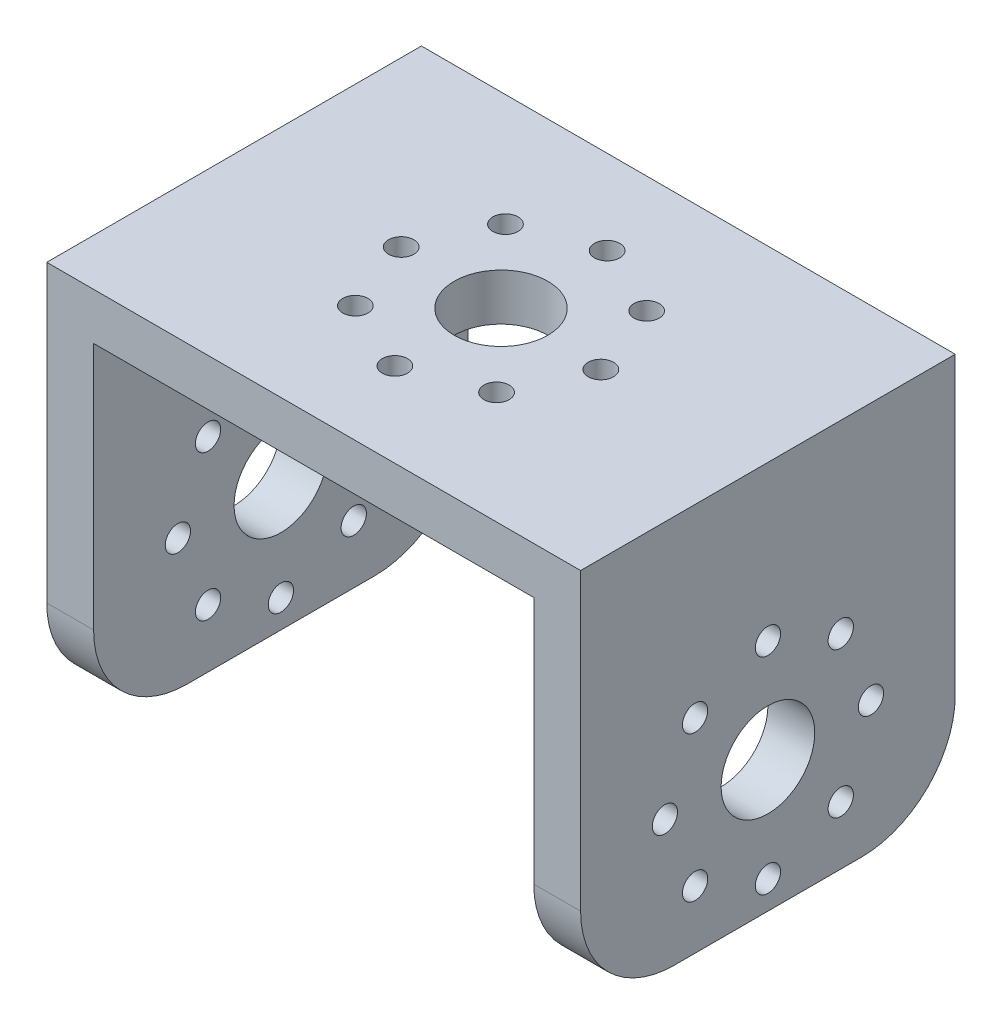
from build123d import *

# Parameters (mm, degrees)
SKETCH4_R               = 5
SKETCH4_R_2             = 1.35
BOSS_EXTRUDE1_DEPTH     = 3
SKETCH5_W               = 3
SKETCH5_H               = 40
BOSS_EXTRUDE2_DEPTH     = 60
CUT_EXTRUDE1_DEPTH      = 83.516664984
CUT_EXTRUDE1_DEPTH_BACK = 83.516664984
SKETCH7_R               = 5
SKETCH7_R_2             = 1.35
SKETCH8_R               = 5
SKETCH8_R_2             = 1.35
BOSS_EXTRUDE3_DEPTH     = 2
BOSS_EXTRUDE4_START     = -5
SKETCH10_R              = 5
SKETCH10_R_2            = 1.35
BOSS_EXTRUDE4_DEPTH     = 5
BOSS_EXTRUDE5_START     = -57
BOSS_EXTRUDE5_DEPTH     = 5


with BuildPart() as part:
    # Sketch4 → Boss-Extrude1 (new body)
    with BuildSketch(Plane(origin=(0, 0, 0), x_dir=(1, 0, 0), z_dir=(0, 1, 0))):
        Polygon((0, -20), (26.5, -20), (26.5, 20), (0, 20), (-26.5, 20), (-26.5, -20), align=None)
        with Locations(Location((0, 0, 0), (0, 0, 270))):
            Circle(SKETCH4_R, mode=Mode.SUBTRACT)
        with Locations(Location((8.012214677, 7.536870436, 0), (0, 0, 270))):
            Circle(SKETCH4_R_2, mode=Mode.SUBTRACT)
        with Locations(Location((10.994863525, -0.336119137, 0), (0, 0, 270))):
            Circle(SKETCH4_R_2, mode=Mode.SUBTRACT)
        with Locations(Location((0.336119137, 10.994863525, 0), (0, 0, 270))):
            Circle(SKETCH4_R_2, mode=Mode.SUBTRACT)
        with Locations(Location((-7.536870436, 8.012214677, 0), (0, 0, 270))):
            Circle(SKETCH4_R_2, mode=Mode.SUBTRACT)
        with Locations(Location((-10.994863525, 0.336119137, 0), (0, 0, 270))):
            Circle(SKETCH4_R_2, mode=Mode.SUBTRACT)
        with Locations(Location((-8.012214677, -7.536870436, 0), (0, 0, 270))):
            Circle(SKETCH4_R_2, mode=Mode.SUBTRACT)
        with Locations(Location((-0.336119137, -10.994863525, 0), (0, 0, 270))):
            Circle(SKETCH4_R_2, mode=Mode.SUBTRACT)
        with Locations(Location((7.536870436, -8.012214677, 0), (0, 0, 270))):
            Circle(SKETCH4_R_2, mode=Mode.SUBTRACT)
    extrude(amount=BOSS_EXTRUDE1_DEPTH)

    # Sketch5 → Boss-Extrude2 (add)
    with BuildSketch(Plane.XZ):
        with Locations((-25, 0)):
            Rectangle(SKETCH5_W, SKETCH5_H)
        with Locations((25, 0)):
            Rectangle(SKETCH5_W, SKETCH5_H)
    extrude(amount=BOSS_EXTRUDE2_DEPTH)

    # Sketch7 → Cut-Extrude1 (cut, two sides: drawn at the far end of the back side and taken through both)
    with BuildSketch(Plane(origin=(26.5, 0, 0), x_dir=(0, 0, -1), z_dir=(1, 0, 0)).offset(-CUT_EXTRUDE1_DEPTH_BACK)):
        with BuildLine():
            ThreePointArc((-10, -36.5), (-17.071067812, -33.571067812), (-20, -26.5))
            Line((-20, -26.5), (-20, -60))
            Line((-20, -60), (20, -60))
            Line((20, -60), (20, -26.5))
            ThreePointArc((20, -26.5), (17.071067812, -33.571067812), (10, -36.5))
            Line((10, -36.5), (-10, -36.5))
        make_face()
        with Locations((0, -22.5)):
            Circle(SKETCH7_R)
        with Locations((0, -11.5)):
            Circle(SKETCH7_R_2)
        with Locations((7.778174593, -14.721825407)):
            Circle(SKETCH7_R_2)
        with Locations((11, -22.5)):
            Circle(SKETCH7_R_2)
        with Locations((7.778174593, -30.278174593)):
            Circle(SKETCH7_R_2)
        with Locations((0, -33.5)):
            Circle(SKETCH7_R_2)
        with Locations((-7.778174593, -30.278174593)):
            Circle(SKETCH7_R_2)
        with Locations((-11, -22.5)):
            Circle(SKETCH7_R_2)
        with Locations((-7.778174593, -14.721825407)):
            Circle(SKETCH7_R_2)
    extrude(amount=CUT_EXTRUDE1_DEPTH + CUT_EXTRUDE1_DEPTH_BACK, mode=Mode.SUBTRACT)

    # Sketch8 → Boss-Extrude3 (add)
    with BuildSketch(Plane(origin=(0, 3, 0), x_dir=(1, 0, 0), z_dir=(0, 1, 0))):
        Polygon((-26.5, 20), (26.5, 20), (28.5, 20), (28.5, -20), (26.5, -20), (-26.5, -20), (-28.5, -20), (-28.5, 20), align=None)
        with Locations(Location((0, 0, 0), (0, 0, 270))):
            Circle(SKETCH8_R, mode=Mode.SUBTRACT)
        with Locations(Location((8.012214677, 7.536870436, 0), (0, 0, 270))):
            Circle(SKETCH8_R_2, mode=Mode.SUBTRACT)
        with Locations(Location((0.336119137, 10.994863525, 0), (0, 0, 270))):
            Circle(SKETCH8_R_2, mode=Mode.SUBTRACT)
        with Locations(Location((-7.536870436, 8.012214677, 0), (0, 0, 270))):
            Circle(SKETCH8_R_2, mode=Mode.SUBTRACT)
        with Locations(Location((-10.994863525, 0.336119137, 0), (0, 0, 270))):
            Circle(SKETCH8_R_2, mode=Mode.SUBTRACT)
        with Locations(Location((-8.012214677, -7.536870436, 0), (0, 0, 270))):
            Circle(SKETCH8_R_2, mode=Mode.SUBTRACT)
        with Locations(Location((-0.336119137, -10.994863525, 0), (0, 0, 270))):
            Circle(SKETCH8_R_2, mode=Mode.SUBTRACT)
        with Locations(Location((7.536870436, -8.012214677, 0), (0, 0, 270))):
            Circle(SKETCH8_R_2, mode=Mode.SUBTRACT)
        with Locations(Location((10.994863525, -0.336119137, 0), (0, 0, 270))):
            Circle(SKETCH8_R_2, mode=Mode.SUBTRACT)
    extrude(amount=BOSS_EXTRUDE3_DEPTH)

    # Sketch10 → Boss-Extrude4 (add)
    with BuildSketch(Plane.ZY.offset(28.5).offset(BOSS_EXTRUDE4_START)):
        with BuildLine():
            Line((-20, 3), (-20, -26.5))
            ThreePointArc((-20, -26.5), (-17.071067812, -33.571067812), (-10, -36.5))
            Line((-10, -36.5), (10, -36.5))
            ThreePointArc((10, -36.5), (17.071067812, -33.571067812), (20, -26.5))
            Line((20, -26.5), (20, 3))
            Line((20, 3), (-20, 3))
        make_face()
        with Locations(Location((0, -22.5, 0), (0, 0, 180))):
            Circle(SKETCH10_R, mode=Mode.SUBTRACT)
        with Locations(Location((-7.778174593, -14.721825407, 0), (0, 0, 180))):
            Circle(SKETCH10_R_2, mode=Mode.SUBTRACT)
        with Locations(Location((-11, -22.5, 0), (0, 0, 180))):
            Circle(SKETCH10_R_2, mode=Mode.SUBTRACT)
        with Locations(Location((-7.778174593, -30.278174593, 0), (0, 0, 180))):
            Circle(SKETCH10_R_2, mode=Mode.SUBTRACT)
        with Locations(Location((0, -33.5, 0), (0, 0, 180))):
            Circle(SKETCH10_R_2, mode=Mode.SUBTRACT)
        with Locations(Location((7.778174593, -30.278174593, 0), (0, 0, 180))):
            Circle(SKETCH10_R_2, mode=Mode.SUBTRACT)
        with Locations(Location((11, -22.5, 0), (0, 0, 180))):
            Circle(SKETCH10_R_2, mode=Mode.SUBTRACT)
        with Locations(Location((7.778174593, -14.721825407, 0), (0, 0, 180))):
            Circle(SKETCH10_R_2, mode=Mode.SUBTRACT)
        with Locations(Location((0, -11.5, 0), (0, 0, 180))):
            Circle(SKETCH10_R_2, mode=Mode.SUBTRACT)
    extrude(amount=BOSS_EXTRUDE4_DEPTH)

    # Sketch10 → Boss-Extrude5 (add)
    with BuildSketch(Plane.ZY.offset(28.5).offset(BOSS_EXTRUDE5_START)):
        with BuildLine():
            Line((-20, 3), (-20, -26.5))
            ThreePointArc((-20, -26.5), (-17.071067812, -33.571067812), (-10, -36.5))
            Line((-10, -36.5), (10, -36.5))
            ThreePointArc((10, -36.5), (17.071067812, -33.571067812), (20, -26.5))
            Line((20, -26.5), (20, 3))
            Line((20, 3), (-20, 3))
        make_face()
        with Locations(Location((0, -22.5, 0), (0, 0, 180))):
            Circle(SKETCH10_R, mode=Mode.SUBTRACT)
        with Locations(Location((-7.778174593, -14.721825407, 0), (0, 0, 180))):
            Circle(SKETCH10_R_2, mode=Mode.SUBTRACT)
        with Locations(Location((-11, -22.5, 0), (0, 0, 180))):
            Circle(SKETCH10_R_2, mode=Mode.SUBTRACT)
        with Locations(Location((-7.778174593, -30.278174593, 0), (0, 0, 180))):
            Circle(SKETCH10_R_2, mode=Mode.SUBTRACT)
        with Locations(Location((0, -33.5, 0), (0, 0, 180))):
            Circle(SKETCH10_R_2, mode=Mode.SUBTRACT)
        with Locations(Location((7.778174593, -30.278174593, 0), (0, 0, 180))):
            Circle(SKETCH10_R_2, mode=Mode.SUBTRACT)
        with Locations(Location((11, -22.5, 0), (0, 0, 180))):
            Circle(SKETCH10_R_2, mode=Mode.SUBTRACT)
        with Locations(Location((7.778174593, -14.721825407, 0), (0, 0, 180))):
            Circle(SKETCH10_R_2, mode=Mode.SUBTRACT)
        with Locations(Location((0, -11.5, 0), (0, 0, 180))):
            Circle(SKETCH10_R_2, mode=Mode.SUBTRACT)
    extrude(amount=BOSS_EXTRUDE5_DEPTH)


solid = part.part
